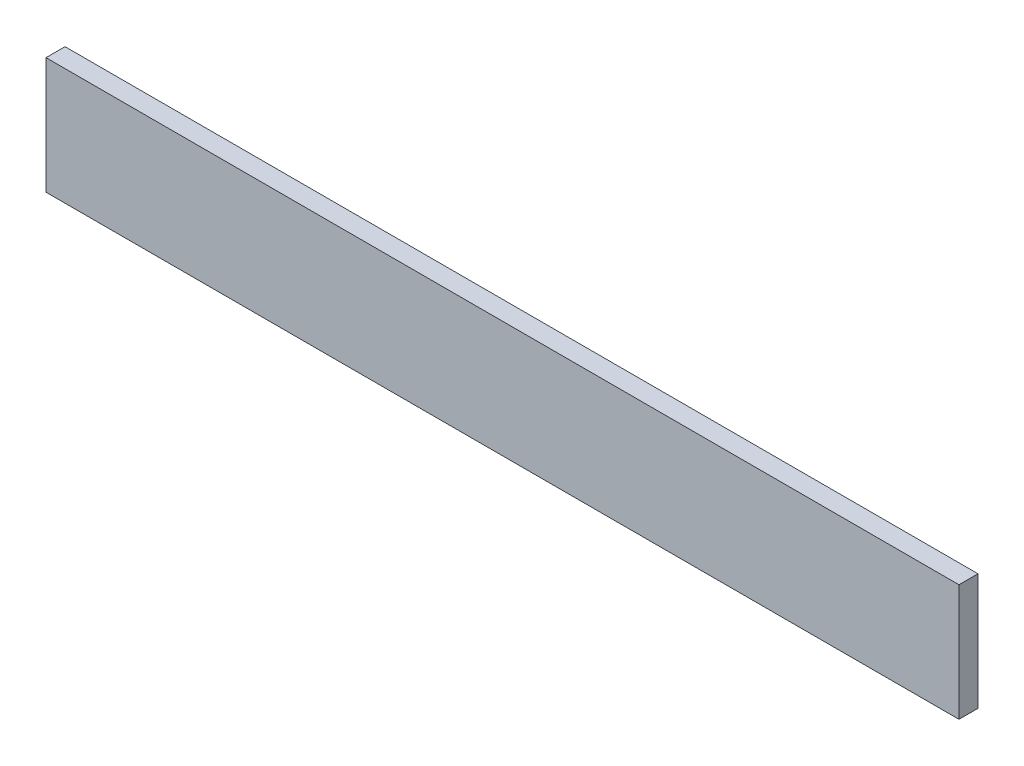
from build123d import *

# Parameters (mm, degrees)
SKETCH1_W           = 914.4
SKETCH1_H           = 116.743329632
BOSS_EXTRUDE1_DEPTH = 19.05


with BuildPart() as part:
    # Sketch1 → Boss-Extrude1 (new body)
    with BuildSketch(Plane.XY):
        with Locations((332.779375255, -22.431982888)):
            Rectangle(SKETCH1_W, SKETCH1_H)
    extrude(amount=BOSS_EXTRUDE1_DEPTH)


solid = part.part
